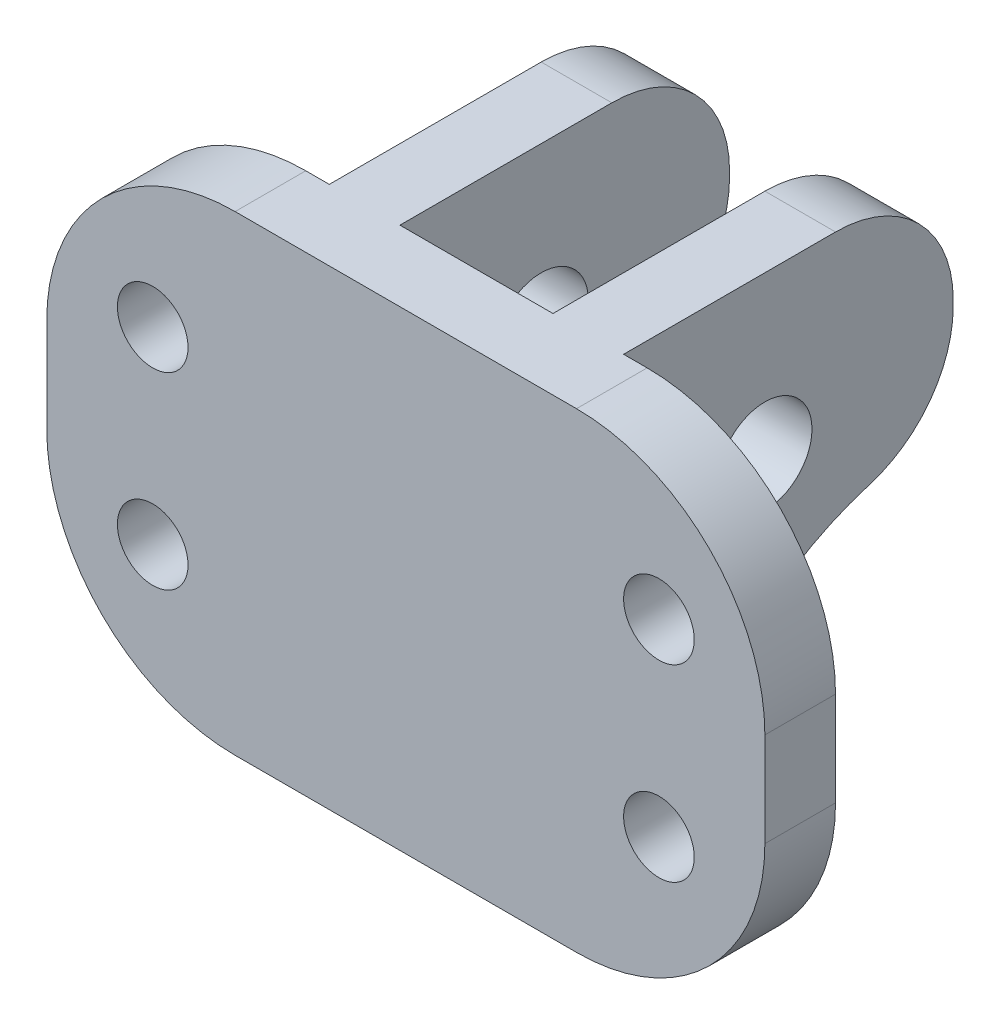
from build123d import *

# Parameters (mm, degrees)
EXTRUDE_1_DEPTH     = 27
SKETCH_3_R          = 2
CUT_EXTRUDE_2_DEPTH = 31.943496894
FILLET_1_R          = 5
SKETCH_4_W          = 9
SKETCH_4_H          = 27
SKETCH_4_R          = 1.5
EXTRUDE_2_DEPTH     = 3
FILLET_2_R          = 8
SKETCH_5_W          = 38.66542969
SKETCH_5_H          = 14
CUT_EXTRUDE_3_DEPTH = 36.363293116
FILLET_3_R          = 5
FILLET_4_R          = 8
SKETCH_6_R          = 12.5
CUT_EXTRUDE_5_DEPTH = 36.545745174
FILLET_5_R          = 5


with BuildPart() as part:
    # 草图1 → 凸台-拉伸1 (new body)
    with BuildSketch(Plane(origin=(0, 0, 0), x_dir=(1, 0, 0), z_dir=(0, 1, 0))):
        Polygon((-6.25, 8.5), (-6.25, -8.5), (6.25, -8.5), (6.25, 8.5), (3.25, 8.5), (3.25, -5.5), (-3.25, -5.5), (-3.25, 8.5), align=None)
    extrude(amount=EXTRUDE_1_DEPTH)

    # 草图3 → 切除-拉伸2 (cut, through all)
    with BuildSketch(Plane(origin=(6.25, 0, 0), x_dir=(0, 0, -1), z_dir=(1, 0, 0))):
        with Locations((0.5, 20.25)):
            Circle(SKETCH_3_R)
    extrude(amount=-CUT_EXTRUDE_2_DEPTH, mode=Mode.SUBTRACT)

    # 圆角1
    fillet_1_edges = [part.edges().sort_by_distance(p)[0] for p in [
        (-4.75, 0, -8.5),
        (4.75, 0, -8.5),
        (-4.75, 27, -8.5),
        (4.75, 27, -8.5),
    ]]
    fillet(fillet_1_edges, radius=FILLET_1_R)

    # 草图4 → 凸台-拉伸2 (add)
    # profile 1 of 2: a face of its own
    with BuildSketch(Plane.XY.offset(8.5)):
        with Locations((-10.75, 13.5)):
            Rectangle(SKETCH_4_W, SKETCH_4_H)
        with Locations((-10.75, 13)):
            Circle(SKETCH_4_R, mode=Mode.SUBTRACT)
        with Locations((-10.75, 21)):
            Circle(SKETCH_4_R, mode=Mode.SUBTRACT)
    # profile 2 of 2: a face of its own
    with BuildSketch(Plane.XY.offset(8.5)):
        with Locations((10.75, 13.5)):
            Rectangle(SKETCH_4_W, SKETCH_4_H)
        with Locations((10.75, 13)):
            Circle(SKETCH_4_R, mode=Mode.SUBTRACT)
        with Locations((10.75, 21)):
            Circle(SKETCH_4_R, mode=Mode.SUBTRACT)
    extrude(amount=-EXTRUDE_2_DEPTH)

    # 圆角2
    fillet_2_edges = [part.edges().sort_by_distance(p)[0] for p in [
        (-15.25, 27, 7),
        (15.25, 27, 7),
    ]]
    fillet(fillet_2_edges, radius=FILLET_2_R)

    # 草图5 → 切除-拉伸3 (cut, through all)
    with BuildSketch(Plane.XY.offset(8.5)):
        Rectangle(SKETCH_5_W, SKETCH_5_H)
    extrude(amount=-CUT_EXTRUDE_3_DEPTH, mode=Mode.SUBTRACT)

    # 圆角3
    fillet_3_edges = [part.edges().sort_by_distance(p)[0] for p in [
        (4.75, 7, -8.5),
        (-4.75, 7, -8.5),
    ]]
    fillet(fillet_3_edges, radius=FILLET_3_R)

    # 圆角4
    fillet_4_edges = [part.edges().sort_by_distance(p)[0] for p in [
        (-15.25, 7, 7),
        (15.25, 7, 7),
    ]]
    fillet(fillet_4_edges, radius=FILLET_4_R)

    # 草图6 → 切除-拉伸5 (cut, through all)
    with BuildSketch(Plane(origin=(6.25, 0, 0), x_dir=(0, 0, -1), z_dir=(1, 0, 0))):
        with Locations((8.5, 5)):
            Circle(SKETCH_6_R)
    extrude(amount=-CUT_EXTRUDE_5_DEPTH, mode=Mode.SUBTRACT)

    # 圆角5
    fillet_5_edges = [part.edges().sort_by_distance(p)[0] for p in [
        (4.75, 17.5, -8.5),
        (-4.75, 17.5, -8.5),
    ]]
    fillet(fillet_5_edges, radius=FILLET_5_R)


solid = part.part
